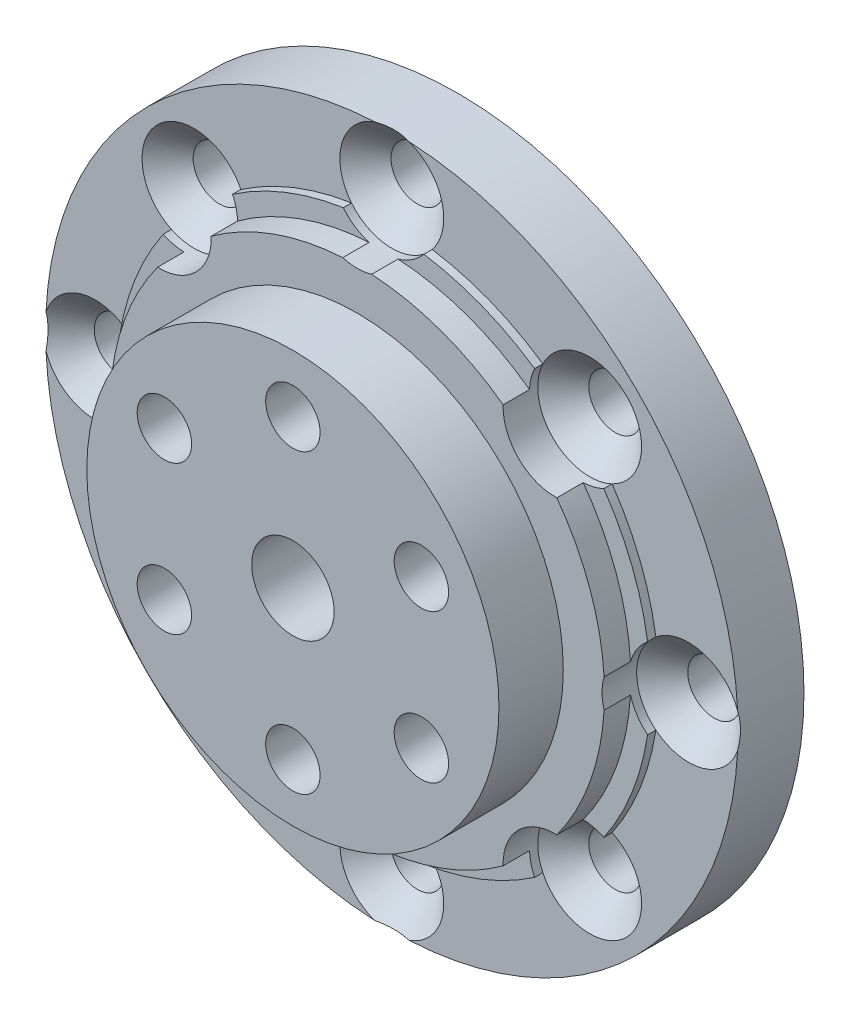
from build123d import *

# Parameters (mm, degrees)
SKETCH_1_R                  = 15
EXTRUDE_1_DEPTH             = 6.1
SKETCH_1_3_R                = 12.5
EXTRUDE_2_DEPTH             = 10
SKETCH_1_4_R                = 21
EXTRUDE_3_DEPTH             = 4
EXTRUDE_START               = 4
SKETCH_1_6_R                = 16.2
EXTRUDE_4_DEPTH             = 0.5
HOLE_WIZARD_M3_1_AT_2_COUNT = 2
HOLE_WIZARD_M3_1_AT_2_PITCH = 25.455844123
HOLE_WIZARD_M3_1_AT_3_COUNT = 2
HOLE_WIZARD_M3_1_AT_3_PITCH = 36
HOLE_WIZARD_M3_1_AT_4_COUNT = 2
HOLE_WIZARD_M3_1_AT_4_PITCH = 25.455844123
HOLE_WIZARD_M3_2_AT_2_COUNT = 2
HOLE_WIZARD_M3_2_AT_2_PITCH = 24
HOLE_WIZARD_M3_2_AT_3_COUNT = 2
HOLE_WIZARD_M3_2_AT_3_PITCH = 24
HOLE_WIZARD_M3_2_AT_4_COUNT = 2
HOLE_WIZARD_M3_2_AT_4_PITCH = 33.941125497
M5X0_8_1_D                  = 5
PATTERN_CIRCULAR_1_COUNT    = 6
CUT_EXTRUDE_START           = 4
SKETCH_5_R                  = 3.15
CUT_EXTRUDE_3_DEPTH         = 2.1


with BuildPart() as part:
    # ｽｹｯﾁ1 → ﾎﾞｽ - 押し出し1 (new body)
    with BuildSketch(Plane.XY):
        Circle(SKETCH_1_R)
    extrude(amount=EXTRUDE_1_DEPTH)

    # ｽｹｯﾁ1<3> → ﾎﾞｽ - 押し出し2 (add)
    with BuildSketch(Plane.XY):
        Circle(SKETCH_1_3_R)
    extrude(amount=EXTRUDE_2_DEPTH)

    # ｽｹｯﾁ1<4> → ﾎﾞｽ - 押し出し3 (add)
    with BuildSketch(Plane.XY):
        Circle(SKETCH_1_4_R)
    extrude(amount=EXTRUDE_3_DEPTH)

    # ｽｹｯﾁ1<6> → ﾎﾞｽ - 押し出し4 (add)
    with BuildSketch(Plane.XY.offset(EXTRUDE_START)):
        Circle(SKETCH_1_6_R)
    extrude(amount=EXTRUDE_4_DEPTH)

    # ｽｹｯﾁ2 → M3 丸皿ねじ用皿穴1 (revolve, cut)
    with BuildSketch(Plane(origin=(0, 18, 4), x_dir=(0, -1, 0), z_dir=(1, 0, 0))):
        Polygon((0, 0), (0, 4), (1.6, 4), (1.6, 1.55), (3.15, 0), align=None)
    hole_wizard_m3_1 = revolve(axis=Axis((0, 18, 10.35), (0, 0, -1)), mode=Mode.SUBTRACT)

    # M3 丸皿ねじ用皿穴1 at 2: M3 丸皿ねじ用皿穴1 ×2
    with Locations(*[Vector(-0.7071067811865476, -0.7071067811865476, 0) * (i * HOLE_WIZARD_M3_1_AT_2_PITCH) for i in range(1, HOLE_WIZARD_M3_1_AT_2_COUNT)]):
        add(hole_wizard_m3_1, mode=Mode.SUBTRACT)

    # M3 丸皿ねじ用皿穴1 at 3: M3 丸皿ねじ用皿穴1 ×2
    with Locations(*[(0, -i * HOLE_WIZARD_M3_1_AT_3_PITCH, 0) for i in range(1, HOLE_WIZARD_M3_1_AT_3_COUNT)]):
        add(hole_wizard_m3_1, mode=Mode.SUBTRACT)

    # M3 丸皿ねじ用皿穴1 at 4: M3 丸皿ねじ用皿穴1 ×2
    with Locations(*[Vector(0.7071067811865415, -0.7071067811865536, 0) * (i * HOLE_WIZARD_M3_1_AT_4_PITCH) for i in range(1, HOLE_WIZARD_M3_1_AT_4_COUNT)]):
        add(hole_wizard_m3_1, mode=Mode.SUBTRACT)

    # ｽｹｯﾁ8 → M3 丸皿ねじ用皿穴2 (revolve, cut)
    with BuildSketch(Plane(origin=(-12, 12, 4), x_dir=(0, -1, 0), z_dir=(1, 0, 0))):
        Polygon((0, 0), (0, 4), (1.6, 4), (1.6, 1.55), (3.15, 0), align=None)
    hole_wizard_m3_2 = revolve(axis=Axis((-12, 12, 10.35), (0, 0, -1)), mode=Mode.SUBTRACT)

    # M3 丸皿ねじ用皿穴2 at 2: M3 丸皿ねじ用皿穴2 ×2
    with Locations(*[(i * HOLE_WIZARD_M3_2_AT_2_PITCH, 0, 0) for i in range(1, HOLE_WIZARD_M3_2_AT_2_COUNT)]):
        add(hole_wizard_m3_2, mode=Mode.SUBTRACT)

    # M3 丸皿ねじ用皿穴2 at 3: M3 丸皿ねじ用皿穴2 ×2
    with Locations(*[(0, -i * HOLE_WIZARD_M3_2_AT_3_PITCH, 0) for i in range(1, HOLE_WIZARD_M3_2_AT_3_COUNT)]):
        add(hole_wizard_m3_2, mode=Mode.SUBTRACT)

    # M3 丸皿ねじ用皿穴2 at 4: M3 丸皿ねじ用皿穴2 ×2
    with Locations(*[Vector(0.7071067811865476, -0.7071067811865476, 0) * (i * HOLE_WIZARD_M3_2_AT_4_PITCH) for i in range(1, HOLE_WIZARD_M3_2_AT_4_COUNT)]):
        add(hole_wizard_m3_2, mode=Mode.SUBTRACT)

    # M5x0.8 ねじ穴1 (through all)
    with Locations(Plane.XY.offset(10)):
        with Locations((0, 0)):
            Hole(M5X0_8_1_D / 2)

    # ｽｹｯﾁ3 → M4x0.7 ねじ穴1 (revolve, cut)
    with BuildSketch(Plane(origin=(0, 9, 10), x_dir=(0, -1, 0), z_dir=(1, 0, 0))):
        Polygon((0, 0), (0, 12.491420021), (1.65, 11.5), (1.65, 0), align=None)
    m4x0_7_1 = revolve(axis=Axis((0, 9, 16.35), (0, 0, -1)), mode=Mode.SUBTRACT)

    # 円形ﾊﾟﾀｰﾝ1: M4x0.7 ねじ穴1 ×6 about axis
    pattern_circular_1_axis = Axis((0, 0, 0), (0, 0, 1))
    for i in range(1, PATTERN_CIRCULAR_1_COUNT):
        add(m4x0_7_1.rotate(pattern_circular_1_axis, i * 360 / PATTERN_CIRCULAR_1_COUNT), mode=Mode.SUBTRACT)

    # ｽｹｯﾁ5 → ｶｯﾄ - 押し出し3 (cut)
    with BuildSketch(Plane.XY.offset(CUT_EXTRUDE_START)):
        with Locations((0, 18)):
            Circle(SKETCH_5_R)
        with Locations((12, -12)):
            Circle(SKETCH_5_R)
        with Locations((18, 0)):
            Circle(SKETCH_5_R)
        with Locations((0, -18)):
            Circle(SKETCH_5_R)
        with Locations((-18, 0)):
            Circle(SKETCH_5_R)
        with Locations((-12, -12)):
            Circle(SKETCH_5_R)
        with Locations((12, 12)):
            Circle(SKETCH_5_R)
        with Locations((-12, 12)):
            Circle(SKETCH_5_R)
    extrude(amount=CUT_EXTRUDE_3_DEPTH, mode=Mode.SUBTRACT)


solid = part.part
